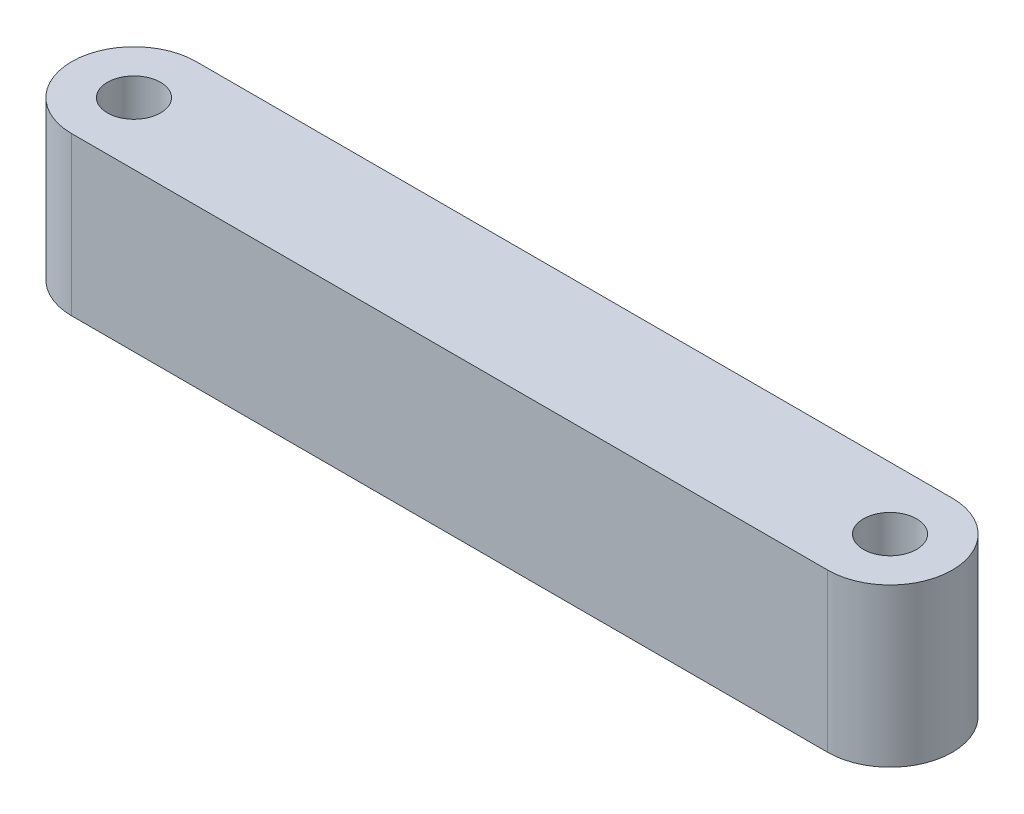
from build123d import *

# Parameters (mm, degrees)
CROQUIS1_W              = 53
CROQUIS1_H              = 7.5
SALIENTE_EXTRUIR1_DEPTH = 9.5
REDONDEO1_RADIUS        = 3.75
REDONDEO1_LENGTH        = 9.5
REDONDEO3_RADIUS        = 3.75
REDONDEO3_LENGTH        = 9.5
CROQUIS2_R              = 1.6
CORTAR_EXTRUIR1_DEPTH   = 29.400044014


with BuildPart() as part:
    # Croquis1 → Saliente-Extruir1 (new body)
    with BuildSketch(Plane(origin=(0, 0, 0), x_dir=(1, 0, 0), z_dir=(0, 1, 0))):
        Rectangle(CROQUIS1_W, CROQUIS1_H)
    extrude(amount=SALIENTE_EXTRUIR1_DEPTH)

    # Redondeo1: full round fillet: the end face becomes a half cylinder, R = half its width
    redondeo1_face = Plane((26.5, 4.75, 0), x_dir=(0, -1, 0), z_dir=(1, 0, 0))  # on the end face: x along it, z out of the body
    redondeo1_slab = redondeo1_face.offset(-REDONDEO1_RADIUS / 2) * Box(REDONDEO1_LENGTH, 2 * REDONDEO1_RADIUS, REDONDEO1_RADIUS, mode=Mode.PRIVATE)  # the body's end, R deep
    redondeo1_round = Plane((22.75, 4.75, 0), x_dir=(1, 0, 0), z_dir=(0, -1, 0)) * Cylinder(REDONDEO1_RADIUS, REDONDEO1_LENGTH, mode=Mode.PRIVATE)  # its axis R under the face
    add(redondeo1_slab - redondeo1_round, mode=Mode.SUBTRACT)

    # Redondeo3: full round fillet: the end face becomes a half cylinder, R = half its width
    redondeo3_face = Plane((-26.5, 4.75, 0), x_dir=(0, 1, 0), z_dir=(-1, 0, 0))  # on the end face: x along it, z out of the body
    redondeo3_slab = redondeo3_face.offset(-REDONDEO3_RADIUS / 2) * Box(REDONDEO3_LENGTH, 2 * REDONDEO3_RADIUS, REDONDEO3_RADIUS, mode=Mode.PRIVATE)  # the body's end, R deep
    redondeo3_round = Plane((-22.75, 4.75, 0), x_dir=(-1, 0, 0), z_dir=(0, 1, 0)) * Cylinder(REDONDEO3_RADIUS, REDONDEO3_LENGTH, mode=Mode.PRIVATE)  # its axis R under the face
    add(redondeo3_slab - redondeo3_round, mode=Mode.SUBTRACT)

    # Croquis2 → Cortar-Extruir1 (cut, through all)
    with BuildSketch(Plane(origin=(0, 9.5, 0), x_dir=(1, 0, 0), z_dir=(0, 1, 0))):
        with Locations(Location((-22.75, 0, 0), (0, 0, 270))):
            Circle(CROQUIS2_R)
        with Locations(Location((22.75, 0, 0), (0, 0, 270))):
            Circle(CROQUIS2_R)
    extrude(amount=-CORTAR_EXTRUIR1_DEPTH, mode=Mode.SUBTRACT)


solid = part.part
